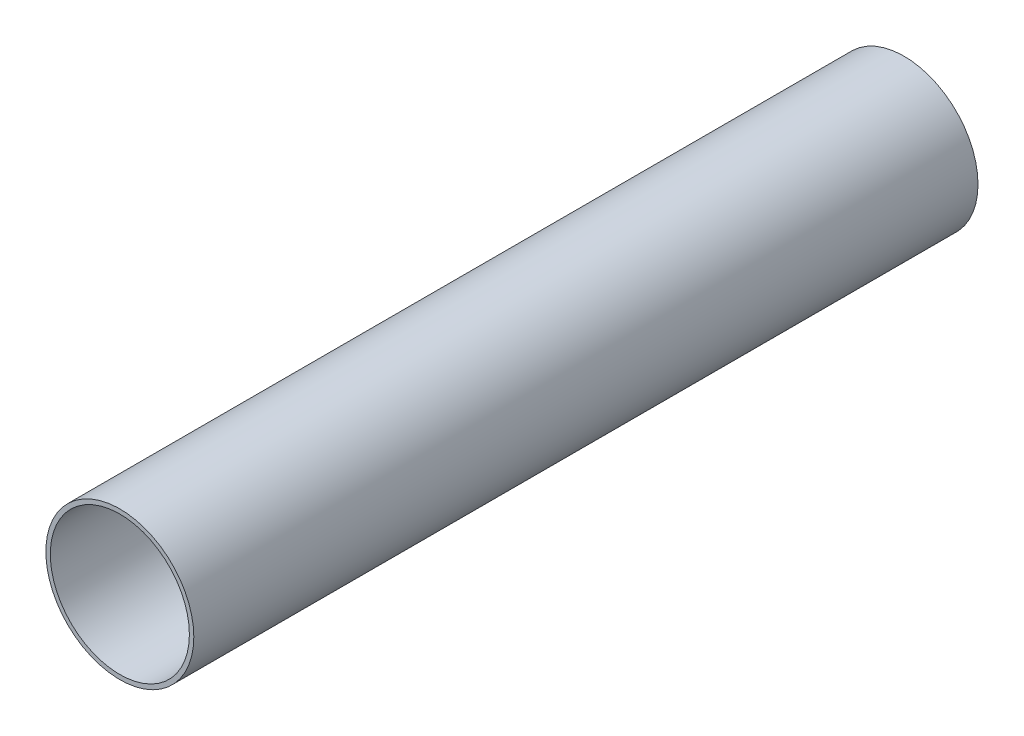
from build123d import *

# Parameters (mm, degrees)
SKETCH1_R           = 50
SKETCH1_R_2         = 47
BOSS_EXTRUDE1_DEPTH = 530
SKETCH2_R           = 34
CUT_EXTRUDE1_DEPTH  = 500


with BuildPart() as part:
    # Sketch1 → Boss-Extrude1 (new body)
    with BuildSketch(Plane.XY):
        Circle(SKETCH1_R)
        Circle(SKETCH1_R_2, mode=Mode.SUBTRACT)
    extrude(amount=BOSS_EXTRUDE1_DEPTH)

    # Sketch2 → Cut-Extrude1 (cut)
    with BuildSketch(Plane(origin=(0, 0, 0), x_dir=(1, 0, 0), z_dir=(0, 1, 0))):
        with Locations(Location((0, -120, 0), (0, 0, 270))):
            Circle(SKETCH2_R)
        with Locations(Location((0, -330, 0), (0, 0, 270))):
            Circle(SKETCH2_R)
    extrude(amount=-CUT_EXTRUDE1_DEPTH, mode=Mode.SUBTRACT)


solid = part.part
